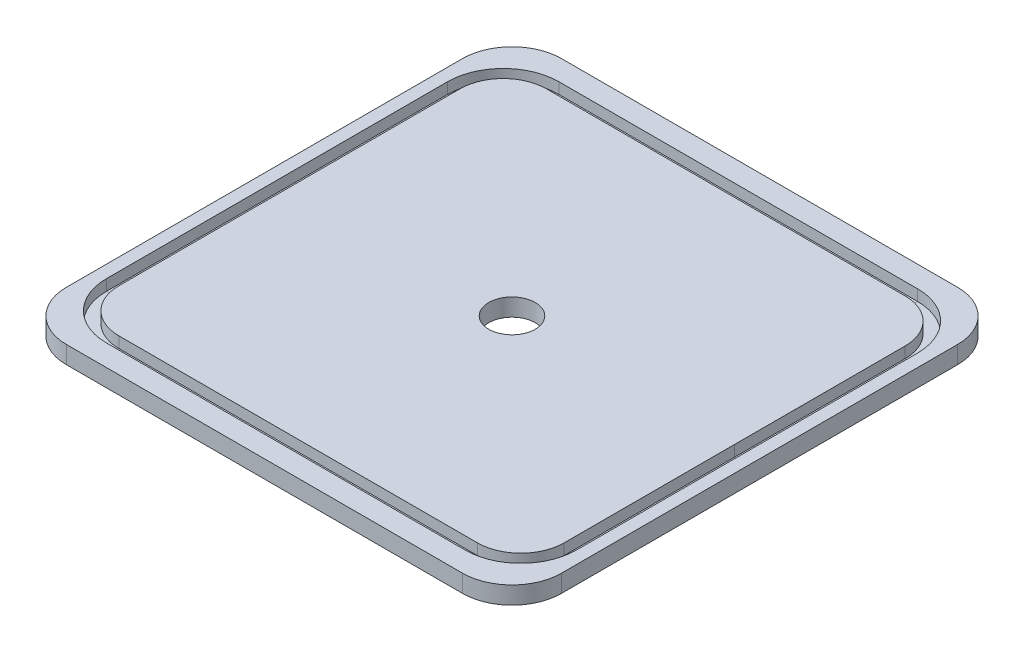
from build123d import *

# Parameters (mm, degrees)
MAIN_BODY_DEPTH      = 2.25
SKETCH29_R           = 5.953125
PNEUMATICMOUNT_DEPTH = 4.5
ORINGINSERTPROFILE_W = 3.17754
ORINGINSERTPROFILE_H = 2.82448


with BuildPart() as part:
    # Sketch1 → main body (new, symmetric)
    with BuildSketch(Plane(origin=(0, 0, 0), x_dir=(1, 0, 0), z_dir=(0, 1, 0))):
        with BuildLine():
            Line((-63.5, 50.8), (-63.5, -50.8))
            ThreePointArc((-63.5, -50.8), (-59.780256121, -59.780256121), (-50.8, -63.5))
            Line((-50.8, -63.5), (50.8, -63.5))
            ThreePointArc((50.8, -63.5), (59.780256121, -59.780256121), (63.5, -50.8))
            Line((63.5, -50.8), (63.5, 50.8))
            ThreePointArc((63.5, 50.8), (59.780256121, 59.780256121), (50.8, 63.5))
            Line((50.8, 63.5), (-50.8, 63.5))
            ThreePointArc((-50.8, 63.5), (-59.780256121, 59.780256121), (-63.5, 50.8))
        make_face()
    extrude(amount=MAIN_BODY_DEPTH, both=True)

    # Sketch29 → PneumaticMount (cut)
    with BuildSketch(Plane(origin=(0, 2.25, 0), x_dir=(1, 0, 0), z_dir=(0, 1, 0))):
        with Locations(Location((0, 0, 0), (0, 0, 270))):
            Circle(SKETCH29_R)
    extrude(amount=-PNEUMATICMOUNT_DEPTH, mode=Mode.SUBTRACT)

    # O-RingInsert: sweep along a path in ORingInsertPath
    with BuildLine(Plane(origin=(0, 2.25, 0), x_dir=(1, 0, 0), z_dir=(0, 1, 0))) as o_ringinsert_path:
        Line((-45.992219207, -56.4388), (45.992219207, -56.4388))
        ThreePointArc((45.992219207, -56.4388), (54.972475328, -52.719056121), (58.692219207, -43.7388))
        Line((58.692219207, -43.7388), (58.692219207, 43.7388))
        ThreePointArc((58.692219207, 43.7388), (54.972475328, 52.719056121), (45.992219207, 56.4388))
        Line((45.992219207, 56.4388), (-45.992219207, 56.4388))
        ThreePointArc((-45.992219207, 56.4388), (-54.972475328, 52.719056121), (-58.692219207, 43.7388))
        Line((-58.692219207, 43.7388), (-58.692219207, -43.7388))
        ThreePointArc((-58.692219207, -43.7388), (-54.972475328, -52.719056121), (-45.992219207, -56.4388))
    # ORingInsertProfile → O-RingInsert (sweep, cut)
    with BuildSketch(Plane.XY):
        with Locations((58.692219207, 0.83776)):
            Rectangle(ORINGINSERTPROFILE_W, ORINGINSERTPROFILE_H)
    sweep(path=o_ringinsert_path.line, mode=Mode.SUBTRACT)


solid = part.part
